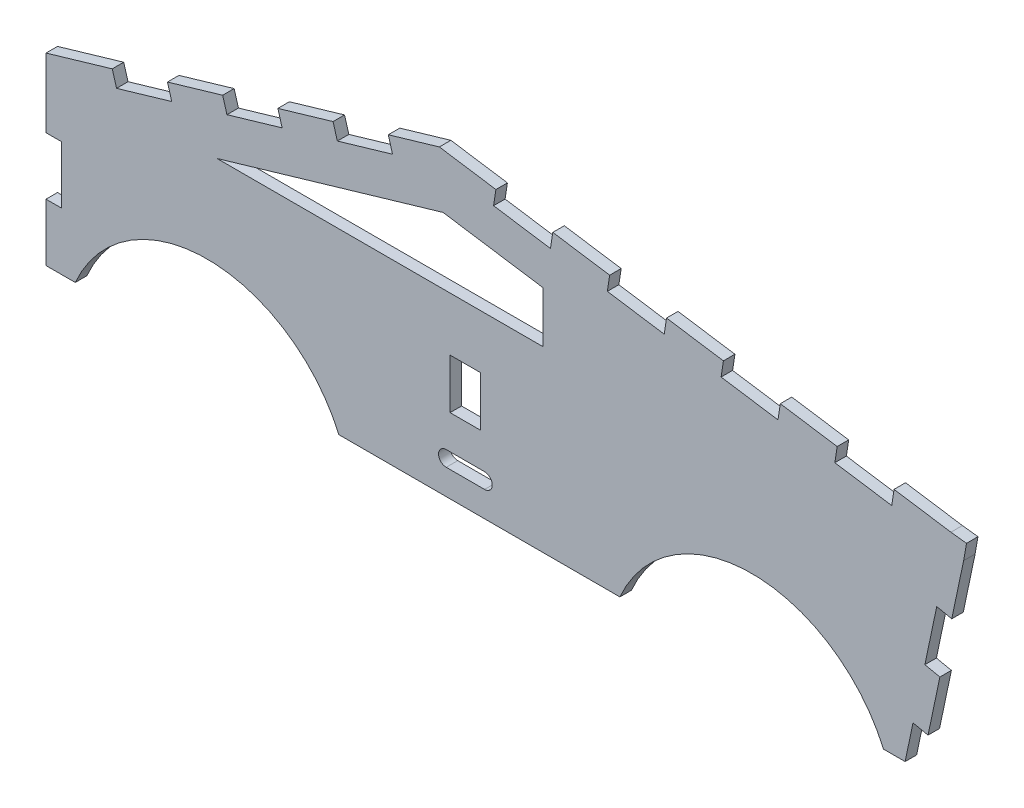
from build123d import *

# Parameters (mm, degrees)
BOSS_EXTRUDE1_DEPTH = 3
SKETCH2_R           = 37.5
CUT_EXTRUDE1_DEPTH  = 3
SKETCH3_W           = 4
SKETCH3_H           = 15
BOSS_EXTRUDE4_DEPTH = 3
SKETCH4_W           = 8
SKETCH4_H           = 13
CUT_EXTRUDE2_DEPTH  = 10
CUT_EXTRUDE3_DEPTH  = 10


with BuildPart() as part:
    # Sketch1 → Boss-Extrude1 (new body)
    with BuildSketch(Plane.XY):
        Polygon((11.337032692, 53.818878563), (0, 0), (-220, 0), (-220, 45), (-121.162967308, 73.986910298), align=None)
        Polygon((-94.409209541, 46.483265917), (-94.409209541, 59.799500594), (-120.476048116, 63.767174765), (-179.409209541, 46.483265917), align=None, mode=Mode.SUBTRACT)
    extrude(amount=-BOSS_EXTRUDE1_DEPTH)

    # Sketch2 → Cut-Extrude1 (cut)
    with BuildSketch(Plane.XY):
        with Locations((-182, -15)):
            Circle(SKETCH2_R)
        with Locations((-40, -15)):
            Circle(SKETCH2_R)
    extrude(amount=-CUT_EXTRUDE1_DEPTH, mode=Mode.SUBTRACT)

    # Sketch3 → Boss-Extrude4 (add)
    with BuildSketch(Plane.XY):
        Polygon((-206.731962629, 53.05972607), (-205.606257375, 49.221394704), (-220, 45), (-220, 30), (-224, 30), (-224, 45), (-224, 47.99535863), (-221.125705254, 48.838331367), align=None)
        Polygon((-192.338220004, 57.281120774), (-191.21251475, 53.442789407), (-176.818772125, 57.664184111), (-177.944477379, 61.502515478), align=None)
        Polygon((-121.437734985, 78.074804512), (-106.694649955, 75.830736536), (-107.296563448, 71.876283331), (-121.162967308, 73.986910298), (-133.63754425, 70.328368222), (-134.763249504, 74.166699588), align=None)
        Polygon((-77.03625092, 71.316385344), (-77.638164413, 67.361932139), (-92.46736393, 69.619107735), (-91.865450438, 73.57356094), align=None)
        Polygon((-3.492166825, 56.076054159), (-2.890253333, 60.030507363), (11.938946184, 57.773331767), (16.003099334, 57.297974706), (15.251132951, 52.994367094), (12.159214944, 38.316491123), (8.245114685, 39.141002591), (11.337032692, 53.818878563), align=None)
        Polygon((-18.321366343, 58.333229755), (-17.719452851, 62.287682959), (-32.548652368, 64.544858556), (-33.15056586, 60.590405351), align=None)
        Polygon((-163.550734754, 65.723910181), (-162.4250295, 61.885578815), (-148.031286875, 66.106973518), (-149.156992129, 69.945304885), align=None)
        Polygon((-47.979765378, 62.847580947), (-47.377851886, 66.802034152), (-62.207051403, 69.059209748), (-62.808964895, 65.104756543), align=None)
        with Locations((-222, 7.5)):
            Rectangle(SKETCH3_W, SKETCH3_H)
        Polygon((5.153196678, 24.463126619), (9.067296937, 23.638615151), (5.97537893, 8.960739179), (2.061278671, 9.785250648), align=None)
    extrude(amount=-BOSS_EXTRUDE4_DEPTH)

    # Sketch4 → Cut-Extrude2 (cut)
    with BuildSketch(Plane.XY):
        with Locations((-114.647846568, 25.97260243)):
            Rectangle(SKETCH4_W, SKETCH4_H)
    extrude(amount=-CUT_EXTRUDE2_DEPTH, mode=Mode.SUBTRACT)

    # Sketch5 → Cut-Extrude3 (cut)
    with BuildSketch(Plane.XY):
        with BuildLine():
            Line((-119.647846568, 10.635241704), (-109.647846568, 10.635241704))
            ThreePointArc((-109.647846568, 10.635241704), (-107.647846568, 8.635241704), (-109.647846568, 6.635241704))
            Line((-109.647846568, 6.635241704), (-119.647846568, 6.635241704))
            ThreePointArc((-119.647846568, 6.635241704), (-121.647846568, 8.635241704), (-119.647846568, 10.635241704))
        make_face()
    extrude(amount=-CUT_EXTRUDE3_DEPTH, mode=Mode.SUBTRACT)


solid = part.part
